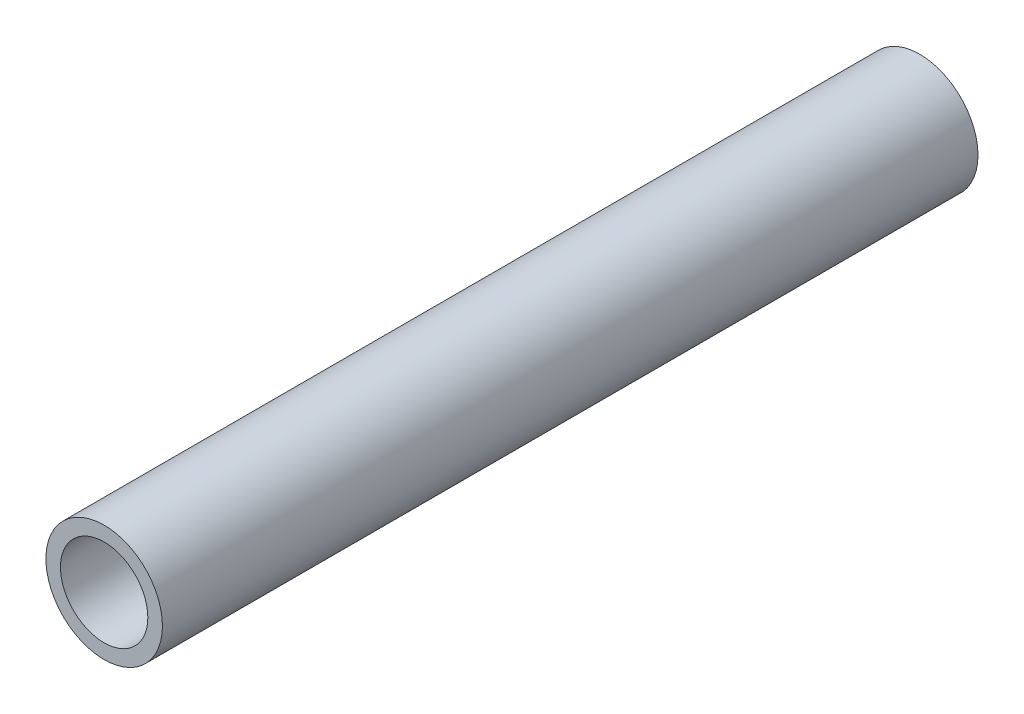
from build123d import *

# Parameters (mm, degrees)
SKETCH1_R           = 20
BOSS_EXTRUDE1_DEPTH = 280
SKETCH2_R           = 15
CUT_EXTRUDE1_DEPTH  = 282.424945589


with BuildPart() as part:
    # Sketch1 → Boss-Extrude1 (new body)
    with BuildSketch(Plane.XY):
        Circle(SKETCH1_R)
    extrude(amount=BOSS_EXTRUDE1_DEPTH)

    # Sketch2 → Cut-Extrude1 (cut, through all)
    with BuildSketch(Plane.XY.offset(280)):
        Circle(SKETCH2_R)
    extrude(amount=-CUT_EXTRUDE1_DEPTH, mode=Mode.SUBTRACT)


solid = part.part
